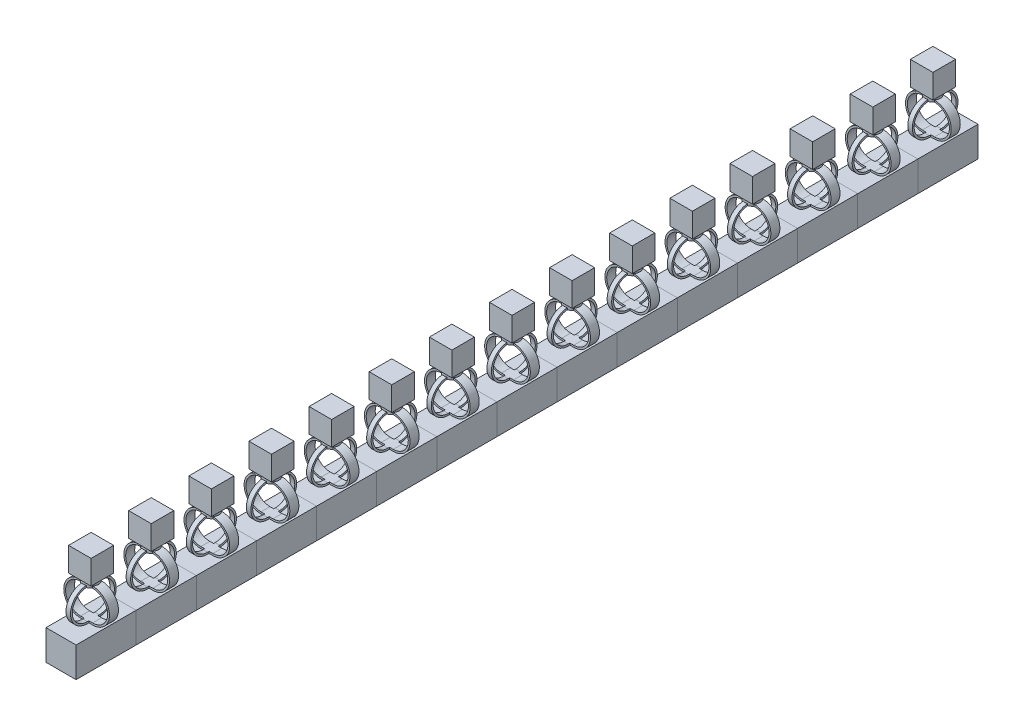
from build123d import *

# Parameters (mm, degrees)
SKETCH1_W           = 10
SKETCH1_H           = 10
BOSS_EXTRUDE1_DEPTH = 10
BOSS_EXTRUDE2_DEPTH = 1.5
BOSS_EXTRUDE3_DEPTH = 0.75
SKETCH4_W           = 7.5
SKETCH4_H           = 7.5
BOSS_EXTRUDE4_DEPTH = 10
CHAMFER1_SIZE       = 2
BOSS_EXTRUDE5_REACH = 26.127
SKETCH5_R           = 2.474873734
LPATTERN2_COUNT     = 15
LPATTERN2_PITCH     = 20


with BuildPart() as part:
    # Sketch1 → Boss-Extrude1 (new, symmetric)
    with BuildSketch(Plane.XY):
        Rectangle(SKETCH1_W, SKETCH1_H)
    extrude(amount=BOSS_EXTRUDE1_DEPTH, both=True)

    # Sketch2 → Boss-Extrude2 (add, symmetric)
    with BuildSketch(Plane.XY):
        with BuildLine():
            Line((0, 5.6), (-2, 5.6))
            ThreePointArc((-2, 5.6), (-7, 10.6), (-2, 15.6))
            Line((-2, 15.6), (0, 15.6))
            Line((0, 15.6), (0, 16.2))
            Line((0, 16.2), (-2, 16.2))
            ThreePointArc((-2, 16.2), (-7.6, 10.6), (-2, 5))
            Line((-2, 5), (0, 5))
            Line((0, 5), (0, 5.6))
        make_face()
    boss_extrude2 = extrude(amount=BOSS_EXTRUDE2_DEPTH, both=True)

    # Mirror1: Boss-Extrude2 across plane
    add(boss_extrude2.mirror(Plane(origin=(0, 0, 0), x_dir=(0, 0, 1), z_dir=(1, 0, 0))))

    # Sketch3 → Boss-Extrude3 (add, symmetric)
    with BuildSketch(Plane(origin=(0, 0, 0), x_dir=(0, 0, -1), z_dir=(1, 0, 0))):
        with BuildLine():
            Line((0, 5), (-2, 5))
            ThreePointArc((-2, 5), (-7.6, 10.6), (-2, 16.2))
            Line((-2, 16.2), (0, 16.2))
            Line((0, 16.2), (0, 15.6))
            Line((0, 15.6), (-2, 15.6))
            ThreePointArc((-2, 15.6), (-7, 10.6), (-2, 5.6))
            Line((-2, 5.6), (0, 5.6))
            Line((0, 5.6), (0, 5))
        make_face()
    boss_extrude3 = extrude(amount=BOSS_EXTRUDE3_DEPTH, both=True)

    # Mirror2: Boss-Extrude3 across plane
    add(boss_extrude3.mirror(Plane.XY))


with BuildPart() as body_2:
    # Sketch4 → Boss-Extrude4 (new body)
    with BuildSketch(Plane(origin=(0, 16.2, 0), x_dir=(1, 0, 0), z_dir=(0, 1, 0))):
        Rectangle(SKETCH4_W, SKETCH4_H)
    extrude(amount=BOSS_EXTRUDE4_DEPTH)

    # Chamfer1
    chamfer1_edges = [body_2.edges().sort_by_distance(p)[0] for p in [
        (0, 16.2, 3.75),
        (-3.75, 16.2, 0),
        (0, 16.2, -3.75),
        (3.75, 16.2, 0),
    ]]
    chamfer(chamfer1_edges, length=CHAMFER1_SIZE)

    # Sketch5 → Boss-Extrude5 (add, up to next)
    with BuildSketch(Plane.XZ.offset(-15.6), mode=Mode.PRIVATE) as boss_extrude5_sk1:
        with Locations(Location((0, 0, 0), (0, 0, 287.640630914))):
            Circle(SKETCH5_R)
    boss_extrude5_tool1 = extrude(boss_extrude5_sk1.sketch, amount=-BOSS_EXTRUDE5_REACH, mode=Mode.PRIVATE) - body_2.part

    add(part.part)  # Boss-Extrude5 merges part
    add(boss_extrude5_tool1.solids().sort_by_distance((0, 15.6, 0))[0])


with BuildPart() as lpattern2_1:
    # LPattern2: pattern copy
    add(body_2.part.moved(Location(Vector(0, 0, 1) * (1 * LPATTERN2_PITCH))))


with BuildPart() as lpattern2_2:
    # LPattern2: pattern copy
    add(body_2.part.moved(Location(Vector(0, 0, 1) * (2 * LPATTERN2_PITCH))))


with BuildPart() as lpattern2_3:
    # LPattern2: pattern copy
    add(body_2.part.moved(Location(Vector(0, 0, 1) * (3 * LPATTERN2_PITCH))))


with BuildPart() as lpattern2_4:
    # LPattern2: pattern copy
    add(body_2.part.moved(Location(Vector(0, 0, 1) * (4 * LPATTERN2_PITCH))))


with BuildPart() as lpattern2_5:
    # LPattern2: pattern copy
    add(body_2.part.moved(Location(Vector(0, 0, 1) * (5 * LPATTERN2_PITCH))))


with BuildPart() as lpattern2_6:
    # LPattern2: pattern copy
    add(body_2.part.moved(Location(Vector(0, 0, 1) * (6 * LPATTERN2_PITCH))))


with BuildPart() as lpattern2_7:
    # LPattern2: pattern copy
    add(body_2.part.moved(Location(Vector(0, 0, 1) * (7 * LPATTERN2_PITCH))))


with BuildPart() as lpattern2_8:
    # LPattern2: pattern copy
    add(body_2.part.moved(Location(Vector(0, 0, 1) * (8 * LPATTERN2_PITCH))))


with BuildPart() as lpattern2_9:
    # LPattern2: pattern copy
    add(body_2.part.moved(Location(Vector(0, 0, 1) * (9 * LPATTERN2_PITCH))))


with BuildPart() as lpattern2_10:
    # LPattern2: pattern copy
    add(body_2.part.moved(Location(Vector(0, 0, 1) * (10 * LPATTERN2_PITCH))))


with BuildPart() as lpattern2_11:
    # LPattern2: pattern copy
    add(body_2.part.moved(Location(Vector(0, 0, 1) * (11 * LPATTERN2_PITCH))))


with BuildPart() as lpattern2_12:
    # LPattern2: pattern copy
    add(body_2.part.moved(Location(Vector(0, 0, 1) * (12 * LPATTERN2_PITCH))))


with BuildPart() as lpattern2_13:
    # LPattern2: pattern copy
    add(body_2.part.moved(Location(Vector(0, 0, 1) * (13 * LPATTERN2_PITCH))))


with BuildPart() as lpattern2_14:
    # LPattern2: pattern copy
    add(body_2.part.moved(Location(Vector(0, 0, 1) * (14 * LPATTERN2_PITCH))))


solid = Compound([body_2.part, lpattern2_1.part, lpattern2_2.part, lpattern2_3.part, lpattern2_4.part, lpattern2_5.part, lpattern2_6.part, lpattern2_7.part, lpattern2_8.part, lpattern2_9.part, lpattern2_10.part, lpattern2_11.part, lpattern2_12.part, lpattern2_13.part, lpattern2_14.part])
